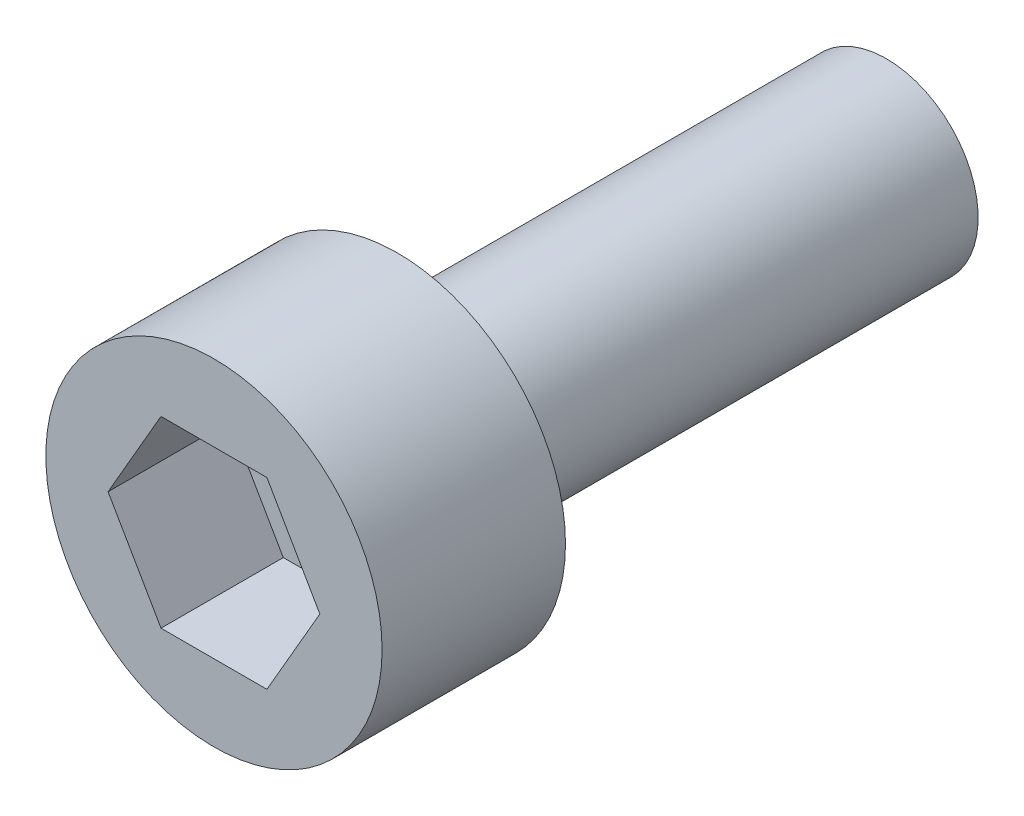
from build123d import *

# Parameters (mm, degrees)
SKETCH_1_R      = 2.75
EXTRUDE_1_DEPTH = 3
SKETCH_2_R      = 1.5
EXTRUDE_2_DEPTH = 8
EXTRUDE_3_DEPTH = 1


with BuildPart() as part:
    # 草图1 → 凸台-拉伸1 (new body)
    with BuildSketch(Plane.XY):
        Circle(SKETCH_1_R)
        Polygon((1.732050808, 0), (0.866025404, 1.5), (-0.866025404, 1.5), (-1.732050808, 0), (-0.866025404, -1.5), (0.866025404, -1.5), align=None, mode=Mode.SUBTRACT)
    extrude(amount=EXTRUDE_1_DEPTH)



with BuildPart() as body_2:
    # 草图2 → 凸台-拉伸2 (new body)
    with BuildSketch(Plane(origin=(0, 0, 0), x_dir=(-1, 0, 0), z_dir=(0, 0, -1))):
        Circle(SKETCH_2_R)
    extrude(amount=EXTRUDE_2_DEPTH)


with BuildPart() as part_1:
    add(part.part)

    add(body_2.part)  # 凸台-拉伸3 merges body 2
    # 草图1<3> → 凸台-拉伸3 (add)
    with BuildSketch(Plane.XY):
        Polygon((-0.866025404, -1.5), (0.866025404, -1.5), (1.732050808, 0), (0.866025404, 1.5), (-0.866025404, 1.5), (-1.732050808, 0), align=None)
    extrude(amount=EXTRUDE_3_DEPTH)


solid = part_1.part
